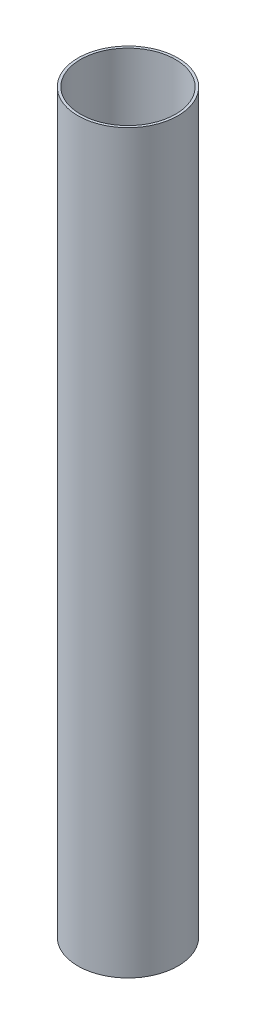
from build123d import *

# Parameters (mm, degrees)
SKETCH1_R           = 33.9725
SKETCH1_R_2         = 32.258
BOSS_EXTRUDE1_DEPTH = 500


with BuildPart() as part:
    # Sketch1 → Boss-Extrude1 (new body)
    with BuildSketch(Plane(origin=(0, 0, 0), x_dir=(1, 0, 0), z_dir=(0, 1, 0))):
        with Locations(Location((0, 0, 0), (0, 0, 270))):
            Circle(SKETCH1_R)
        with Locations(Location((0, 0, 0), (0, 0, 270))):
            Circle(SKETCH1_R_2, mode=Mode.SUBTRACT)
    extrude(amount=BOSS_EXTRUDE1_DEPTH)


solid = part.part
